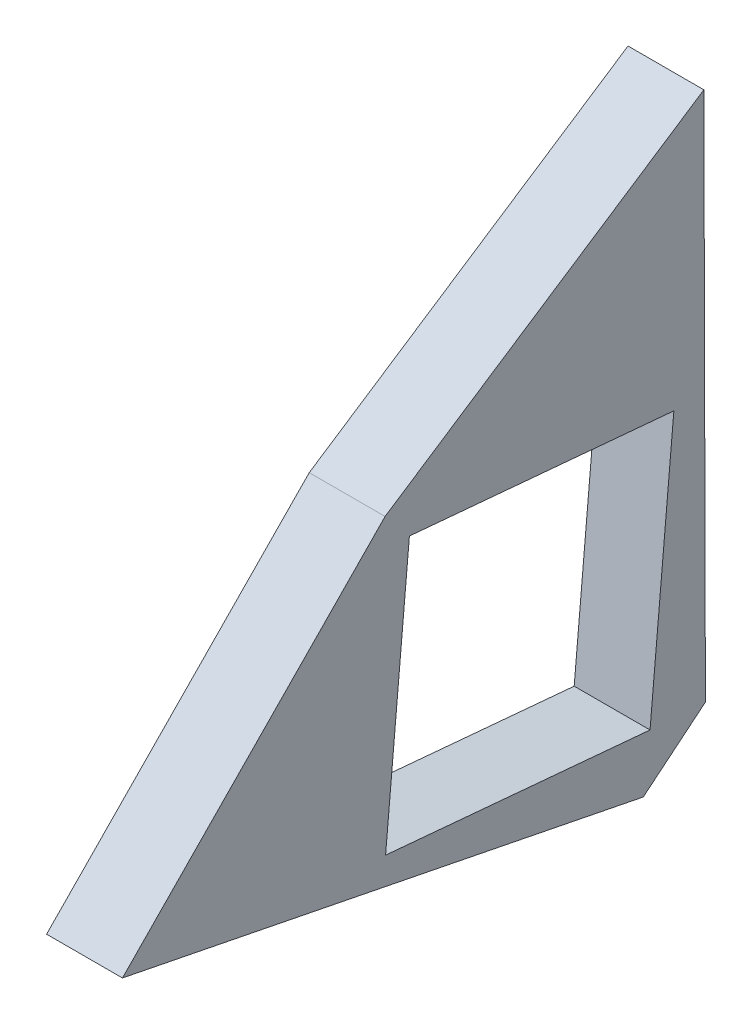
from build123d import *

# Parameters (mm, degrees)
EXTRUDE_1_DEPTH = 4


with BuildPart() as part:
    # Sketch 1 → Бобышка-Вытянуть1 (new body)
    with BuildSketch(Plane(origin=(0, 18.459650088, -6.591530499), x_dir=(-8.942452936584094e-15, -0.6354457681716477, 0.7721455016463832), z_dir=(1, 0, 0))):
        Polygon((0, 0), (20.017301467, -2.12709708), (39.702713782, 0), (21.972488377, 21.671158416), (17.729847698, 21.671467431), align=None)
        Polygon((20.003340082, -0.12714581), (29.833488484, 9.841213252), (19.865129422, 19.671361654), (10.03498102, 9.703002592), align=None, mode=Mode.SUBTRACT)
    extrude(amount=EXTRUDE_1_DEPTH)


solid = part.part
